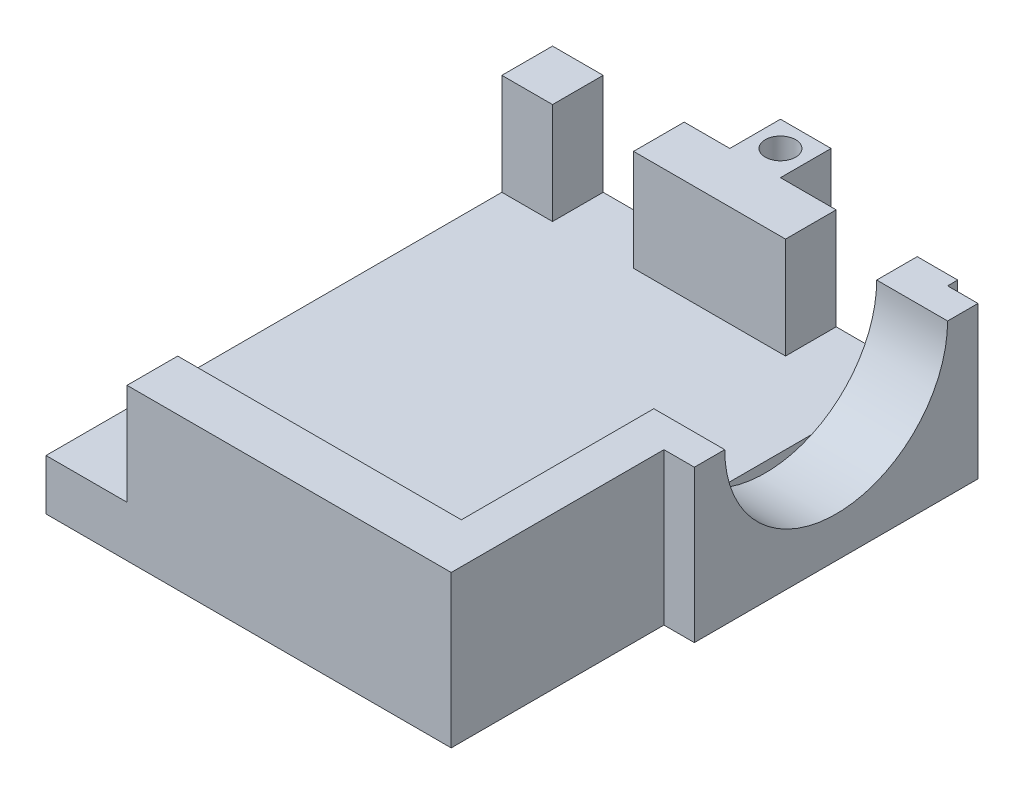
from build123d import *

# Parameters (mm, degrees)
SKETCH1_W           = 40
SKETCH1_H           = 50
BOSS_EXTRUDE1_DEPTH = 5
SKETCH4_W           = 15
SKETCH4_H           = 5
SKETCH4_W_2         = 5
BOSS_EXTRUDE5_DEPTH = 10
CUT_EXTRUDE2_DEPTH  = 4
BOSS_EXTRUDE7_START = 3
BOSS_EXTRUDE7_DEPTH = 3
SKETCH9_W           = 5
SKETCH9_H           = 5
BOSS_EXTRUDE8_DEPTH = 5
SKETCH10_R          = 1.5
CUT_EXTRUDE3_DEPTH  = 5


with BuildPart() as part:
    # Sketch1 → Boss-Extrude1 (new body)
    with BuildSketch(Plane(origin=(0, 0, 0), x_dir=(1, 0, 0), z_dir=(0, 1, 0))):
        Rectangle(SKETCH1_W, SKETCH1_H)
    extrude(amount=BOSS_EXTRUDE1_DEPTH)

    # Sketch4 → Boss-Extrude5 (add)
    with BuildSketch(Plane(origin=(0, 5, 0), x_dir=(1, 0, 0), z_dir=(0, 1, 0))):
        Polygon((20, -25), (20, 25), (16, 25), (16, -20), (-7, -20), (-7, -25), align=None)
        with Locations((0.5, 22.5)):
            Rectangle(SKETCH4_W, SKETCH4_H)
        with Locations((-17.5, 22.5)):
            Rectangle(SKETCH4_W_2, SKETCH4_H)
        with Locations((-9.5, -22.5)):
            Rectangle(SKETCH4_W_2, SKETCH4_H)
    extrude(amount=BOSS_EXTRUDE5_DEPTH)

    # Sketch7 → Cut-Extrude2 (cut)
    with BuildSketch(Plane(origin=(20, 0, 0), x_dir=(0, 0, -1), z_dir=(1, 0, 0))):
        with BuildLine():
            Line((-1, 15), (21, 15))
            ThreePointArc((21, 15), (10, 4), (-1, 15))
        make_face()
    extrude(amount=-CUT_EXTRUDE2_DEPTH, mode=Mode.SUBTRACT)

    # Sketch8 → Boss-Extrude7 (add)
    with BuildSketch(Plane(origin=(20, 0, 0), x_dir=(0, 0, -1), z_dir=(1, 0, 0)).offset(BOSS_EXTRUDE7_START)):
        with BuildLine():
            Line((-1, 15), (-4, 15))
            Line((-4, 15), (-4, 0))
            Line((-4, 0), (24, 0))
            Line((24, 0), (24, 15))
            Line((24, 15), (21, 15))
            ThreePointArc((21, 15), (10, 4), (-1, 15))
        make_face()
    extrude(amount=-BOSS_EXTRUDE7_DEPTH)

    # Sketch9 → Boss-Extrude8 (add)
    with BuildSketch(Plane(origin=(0, 0, -25), x_dir=(-1, 0, 0), z_dir=(0, 0, -1))):
        with Locations((0, 12.5)):
            Rectangle(SKETCH9_W, SKETCH9_H)
    extrude(amount=BOSS_EXTRUDE8_DEPTH)

    # Sketch10 → Cut-Extrude3 (cut)
    with BuildSketch(Plane.XZ.offset(-10)):
        with Locations(Location((0, -27.5, 0), (0, 0, 270))):
            Circle(SKETCH10_R)
    extrude(amount=-CUT_EXTRUDE3_DEPTH, mode=Mode.SUBTRACT)


solid = part.part
